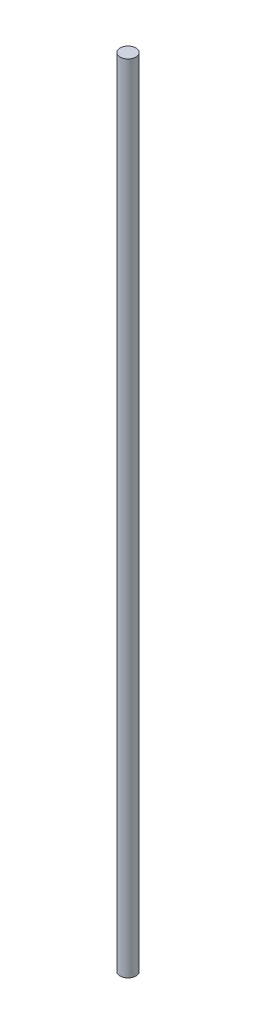
from build123d import *

# Parameters (mm, degrees)
SKETCH1_R           = 4
BOSS_EXTRUDE1_DEPTH = 200


with BuildPart() as part:
    # Sketch1 → Boss-Extrude1 (new, symmetric)
    with BuildSketch(Plane(origin=(0, 0, 0), x_dir=(1, 0, 0), z_dir=(0, 1, 0))):
        with Locations(Location((0, 0, 0), (0, 0, 270))):
            Circle(SKETCH1_R)
    extrude(amount=BOSS_EXTRUDE1_DEPTH, both=True)


solid = part.part
